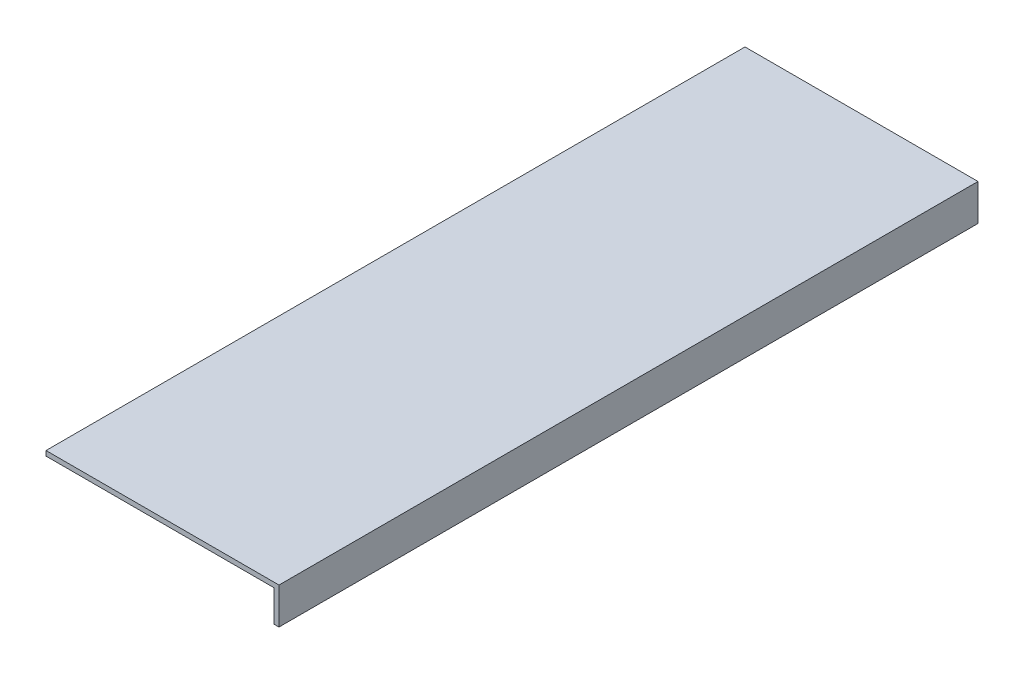
from build123d import *

# Parameters (mm, degrees)
SKETCH1_W           = 152.4
SKETCH1_H           = 457.2
BOSS_EXTRUDE1_DEPTH = 3.175
SKETCH2_W           = 3.175
SKETCH2_H           = 457.2
BOSS_EXTRUDE2_DEPTH = 23.8125


with BuildPart() as part:
    # Sketch1 → Boss-Extrude1 (new body)
    with BuildSketch(Plane(origin=(0, 0, 0), x_dir=(1, 0, 0), z_dir=(0, 1, 0))):
        with Locations((76.2, 228.6)):
            Rectangle(SKETCH1_W, SKETCH1_H)
    extrude(amount=BOSS_EXTRUDE1_DEPTH)

    # Sketch2 → Boss-Extrude2 (add)
    with BuildSketch(Plane(origin=(0, 3.175, 0), x_dir=(1, 0, 0), z_dir=(0, 1, 0))):
        with Locations((150.8125, 228.6)):
            Rectangle(SKETCH2_W, SKETCH2_H)
    extrude(amount=-BOSS_EXTRUDE2_DEPTH)


solid = part.part
